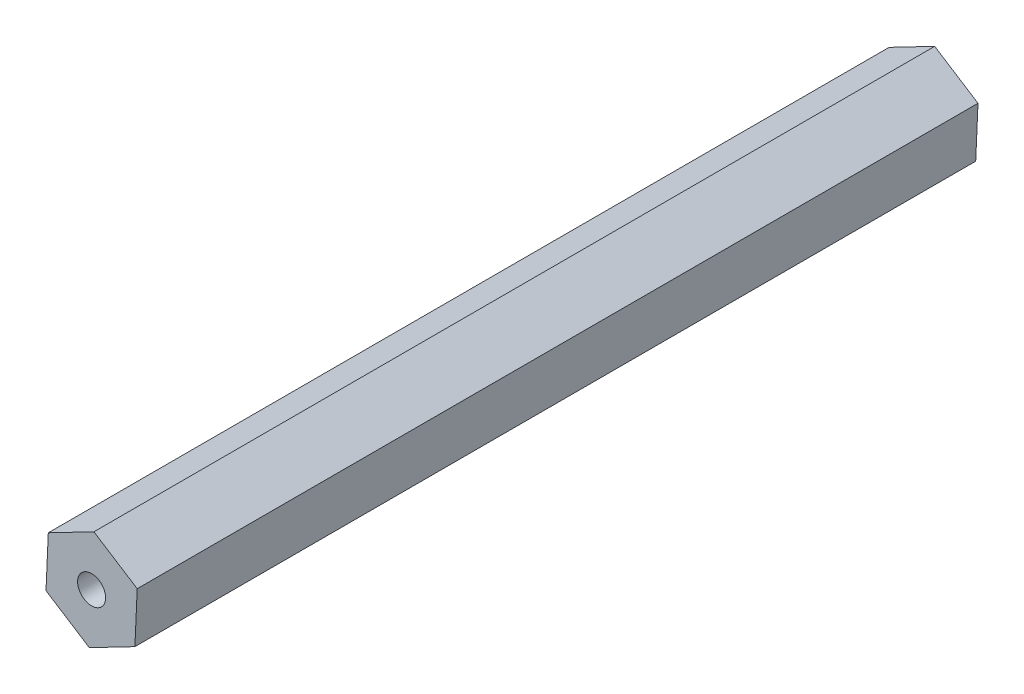
from build123d import *

# Parameters (mm, degrees)
BOSS_EXTRUDE1_DEPTH = 45
SKETCH2_R           = 0.75
CUT_EXTRUDE1_DEPTH  = 5
CUT_EXTRUDE2_START  = -5
SKETCH3_R           = 0.75
CUT_EXTRUDE2_DEPTH  = 5


with BuildPart() as part:
    # Sketch1 → Boss-Extrude1 (new body)
    with BuildSketch(Plane.XY):
        Polygon((2.317732159, -1.480073525), (2.440647352, 1.267178166), (0.122915193, 2.747251691), (-2.317732159, 1.480073525), (-2.440647352, -1.267178166), (-0.122915193, -2.747251691), align=None)
    extrude(amount=BOSS_EXTRUDE1_DEPTH)

    # Sketch2 → Cut-Extrude1 (cut)
    with BuildSketch(Plane.XY.offset(45)):
        Circle(SKETCH2_R)
    extrude(amount=-CUT_EXTRUDE1_DEPTH, mode=Mode.SUBTRACT)

    # Sketch3 → Cut-Extrude2 (cut)
    with BuildSketch(Plane(origin=(0, 0, 0), x_dir=(-1, 0, 0), z_dir=(0, 0, -1)).offset(CUT_EXTRUDE2_START)):
        with Locations(Location((0, 0, 0), (0, 0, 180))):
            Circle(SKETCH3_R)
    extrude(amount=CUT_EXTRUDE2_DEPTH, mode=Mode.SUBTRACT)


solid = part.part
